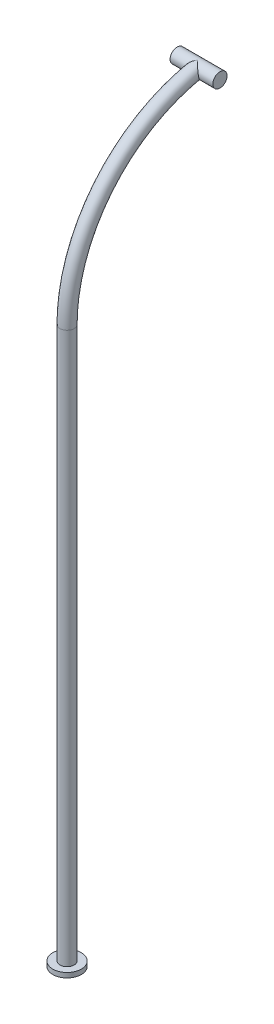
from build123d import *

# Parameters (mm, degrees)
SKETCH1_R                = 1.5
BOSS_EXTRUDE1_DEPTH      = 116
SKETCH4_R                = 3
BOSS_EXTRUDE4_DEPTH      = 1
SKETCH7_R                = 1.5000000000000002
REVOLVE1_ANGLE           = 80.00000000000017
BOSS_EXTRUDE5_DEPTH      = 4.5
BOSS_EXTRUDE5_DEPTH_BACK = 4.5
SKETCH8_R                = 1.5000000000000009


with BuildPart() as part:
    # Sketch1 → Boss-Extrude1 (new body)
    with BuildSketch(Plane(origin=(0, 0, 0), x_dir=(1, 0, 0), z_dir=(0, 1, 0))):
        Circle(SKETCH1_R)
    extrude(amount=BOSS_EXTRUDE1_DEPTH)

    # Sketch4 → Boss-Extrude4 (add)
    with BuildSketch(Plane.XZ):
        Circle(SKETCH4_R)
    extrude(amount=BOSS_EXTRUDE4_DEPTH)

    # Sketch7 → Revolve1 (revolve)
    with BuildSketch(Plane(origin=(0, 116, 0), x_dir=(1, 0, 0), z_dir=(0, 1, 0))):
        Circle(SKETCH7_R)
    revolve(axis=Axis((-42.51012264816653, 116, -33.49999999999999), (-1, 0, 8e-17)), revolution_arc=REVOLVE1_ANGLE)

    # Sketch8 → Boss-Extrude5 (add, two sides: drawn at the far end of the back side and taken through both)
    with BuildSketch(Plane(origin=(0, 0, 0), x_dir=(0, 0, -1), z_dir=(1, 0, 0)).offset(-BOSS_EXTRUDE5_DEPTH_BACK)):
        with Locations((27.682786048157936, 148.99105972590897)):
            Circle(SKETCH8_R)
    extrude(amount=BOSS_EXTRUDE5_DEPTH + BOSS_EXTRUDE5_DEPTH_BACK)


solid = part.part
